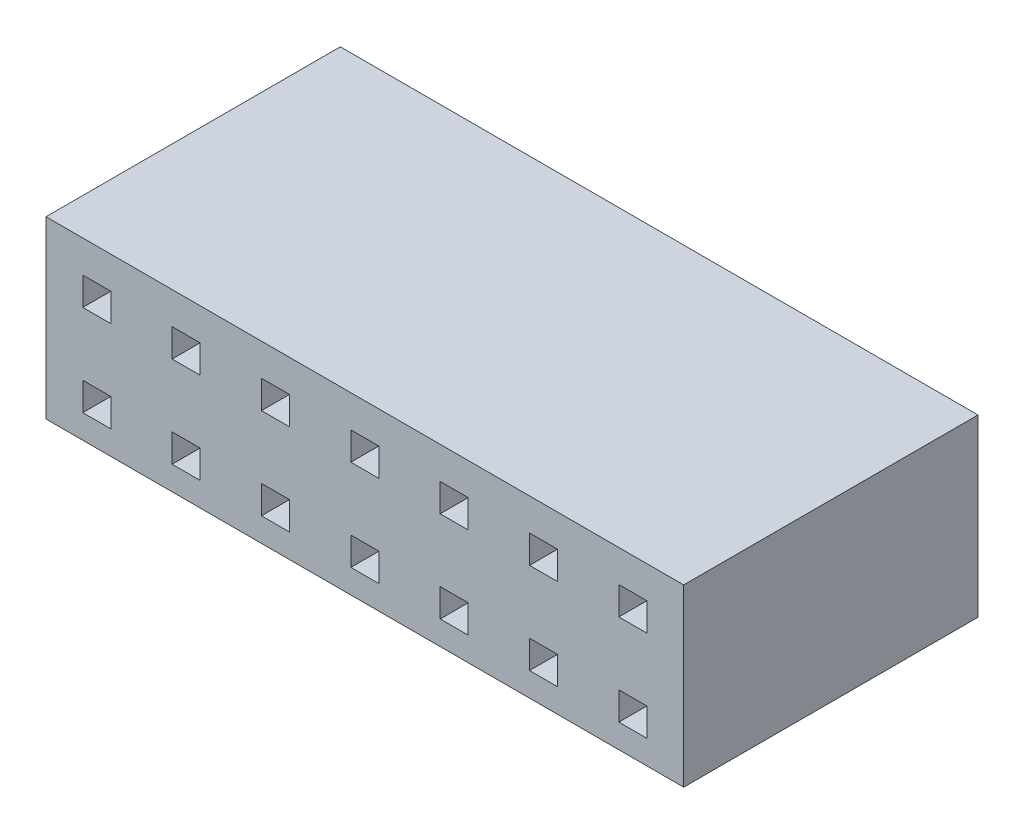
from build123d import *

# Parameters (mm, degrees)
SKICA1_W                 = 18.2
SKICA1_H                 = 5
P_IDAT_VYSUNUT_M1_DEPTH  = 8.4
SKICA3_W                 = 0.8
SKICA3_H                 = 0.8
ODEBRAT_VYSUNUT_M1_DEPTH = 6


with BuildPart() as part:
    # Skica1 → Přidat vysunutím1 (new body)
    with BuildSketch(Plane.XY):
        with Locations((9.1, 2.5)):
            Rectangle(SKICA1_W, SKICA1_H)
    extrude(amount=P_IDAT_VYSUNUT_M1_DEPTH)

    # Skica3 → Odebrat vysunutím1 (cut)
    with BuildSketch(Plane.XY.offset(8.4)):
        with Locations((1.45, 3.682710822)):
            Rectangle(SKICA3_W, SKICA3_H)
        with Locations((1.45, 1.082710822)):
            Rectangle(SKICA3_W, SKICA3_H)
        with Locations((6.55, 3.682710822)):
            Rectangle(SKICA3_W, SKICA3_H)
        with Locations((4, 3.682710822)):
            Rectangle(SKICA3_W, SKICA3_H)
        with Locations((4, 1.082710822)):
            Rectangle(SKICA3_W, SKICA3_H)
        with Locations((6.55, 1.082710822)):
            Rectangle(SKICA3_W, SKICA3_H)
        with Locations((9.1, 3.682710822)):
            Rectangle(SKICA3_W, SKICA3_H)
        with Locations((9.1, 1.082710822)):
            Rectangle(SKICA3_W, SKICA3_H)
        with Locations((11.65, 3.682710822)):
            Rectangle(SKICA3_W, SKICA3_H)
        with Locations((11.65, 1.082710822)):
            Rectangle(SKICA3_W, SKICA3_H)
        with Locations((14.2, 3.682710822)):
            Rectangle(SKICA3_W, SKICA3_H)
        with Locations((14.2, 1.082710822)):
            Rectangle(SKICA3_W, SKICA3_H)
        with Locations((16.75, 3.682710822)):
            Rectangle(SKICA3_W, SKICA3_H)
        with Locations((16.75, 1.082710822)):
            Rectangle(SKICA3_W, SKICA3_H)
    extrude(amount=-ODEBRAT_VYSUNUT_M1_DEPTH, mode=Mode.SUBTRACT)


solid = part.part
